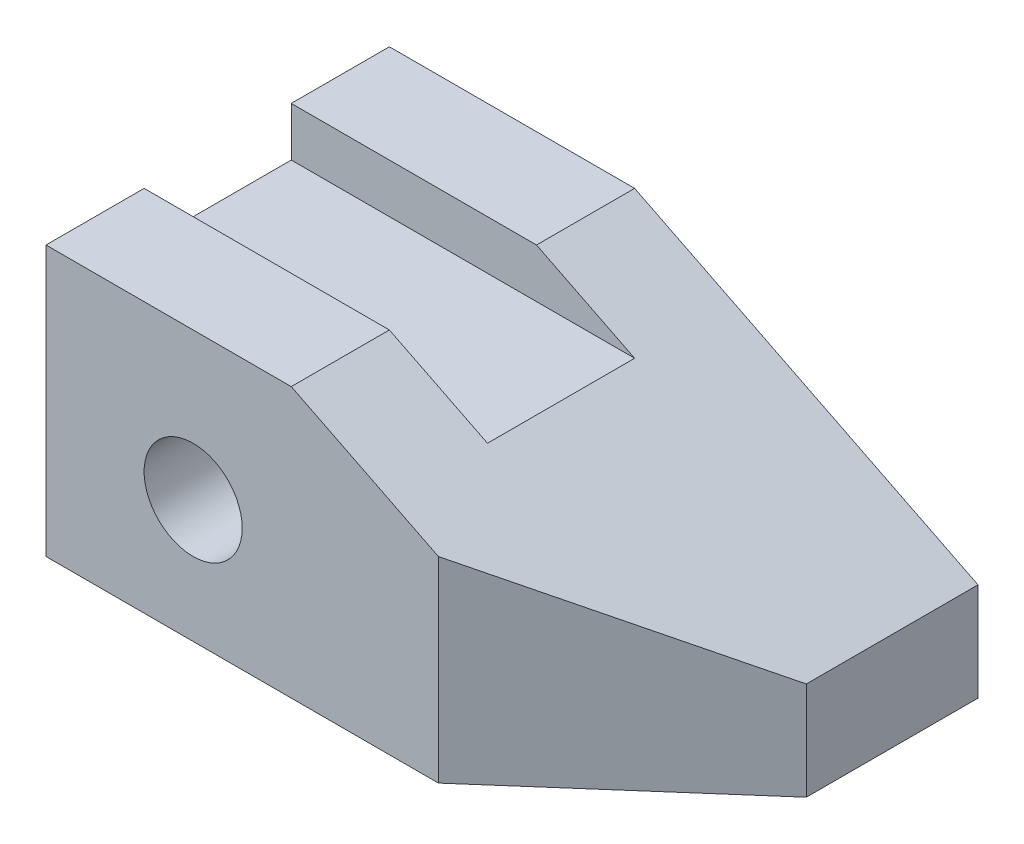
from build123d import *

# Parameters (mm, degrees)
SKETCH2_W           = 152.4
SKETCH2_H           = 88.9
BOSS_EXTRUDE1_DEPTH = 69.85
SKETCH3_R           = 12.7
CUT_EXTRUDE1_DEPTH  = 190.757720528
CUT_EXTRUDE4_DEPTH  = 190.757720528
SKETCH6_W           = 38.1
SKETCH6_H           = 12.7
CUT_EXTRUDE5_DEPTH  = 190.757720528


with BuildPart() as part:
    # Sketch2 → Boss-Extrude1 (new body)
    with BuildSketch(Plane(origin=(0, 0, 0), x_dir=(1, 0, 0), z_dir=(0, 1, 0))):
        with Locations((76.2, 44.45)):
            Rectangle(SKETCH2_W, SKETCH2_H)
    extrude(amount=BOSS_EXTRUDE1_DEPTH)

    # Sketch3 → Cut-Extrude1 (cut, through all)
    with BuildSketch(Plane.XY):
        Polygon((152.4, 69.85), (63.5, 69.85), (152.4, 25.4), align=None)
        with Locations((38.1, 31.75)):
            Circle(SKETCH3_R)
    extrude(amount=-CUT_EXTRUDE1_DEPTH, mode=Mode.SUBTRACT)

    # Sketch5 → Cut-Extrude4 (cut, through all)
    with BuildSketch(Plane(origin=(0, 69.85, 0), x_dir=(1, 0, 0), z_dir=(0, 1, 0))):
        Polygon((101.6, 0), (152.4, 44.45), (152.4, 0), align=None)
    extrude(amount=-CUT_EXTRUDE4_DEPTH, mode=Mode.SUBTRACT)

    # Sketch6 → Cut-Extrude5 (cut, through all)
    with BuildSketch(Plane.ZY):
        with Locations((-44.45, 63.5)):
            Rectangle(SKETCH6_W, SKETCH6_H)
    extrude(amount=-CUT_EXTRUDE5_DEPTH, mode=Mode.SUBTRACT)


solid = part.part
